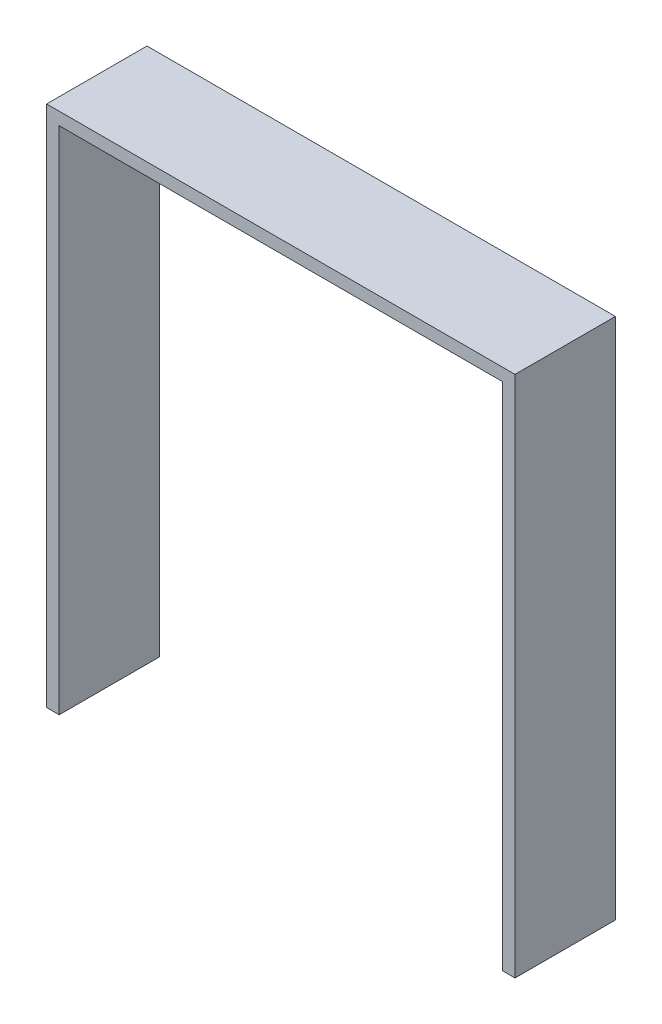
from build123d import *

# Parameters (mm, degrees)
EXTRUDE_2_DEPTH = 24


with BuildPart() as part:
    # 草图1 → Extrude 2 (new body)
    with BuildSketch(Plane.XY):
        Polygon((-3, 0), (-3, 125), (109, 125), (109, 0), (106, 0), (106, 122), (0, 122), (0, 0), align=None)
    extrude(amount=EXTRUDE_2_DEPTH)


solid = part.part
